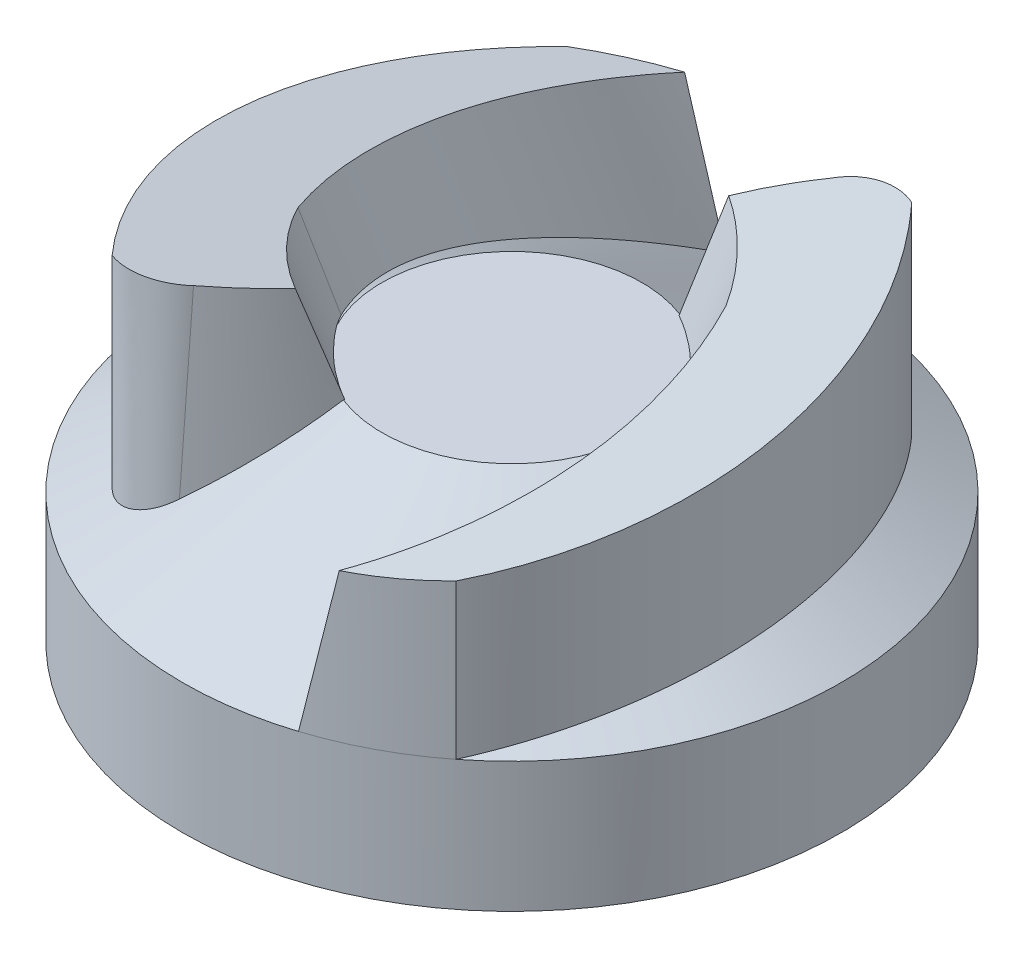
from build123d import *

# Parameters (mm, degrees)
CUT_EXTRUDE_1_DEPTH      = 132.165925626
CUT_EXTRUDE_1_DEPTH_BACK = 132.165925626
PATTERN_CIRCULAR_1_COUNT = 2
CUT_EXTRUDE_2_DEPTH      = 132.165925626


with BuildPart() as part:
    # Эскиз1 → Повернуть1 (revolve)
    with BuildSketch(Plane.XY, mode=Mode.PRIVATE) as revolve_1_sk:
        Polygon((0, 0), (-73.5, 0), (-73.5, 29), (-29, 55), (0, 55), align=None)
    revolve(revolve_1_sk.sketch.rotate(Axis((0, 0, 0), (0, -1, 0)), 270), axis=Axis((0, 0, 0), (0, -1, 0)))

    # Эскиз2 for По сечениям2 → По сечениям2 section 0
    with BuildSketch(Plane(origin=(0, 29, 0), x_dir=(-1, 0, 0), z_dir=(0, -1, 0))):
        with BuildLine():
            # circular arc as an exact rational Bezier (weights 1, cos(half-angle), 1)
            Bezier((39.466469787, -49.694809123), (86.422497659, 1.641217724), (45.380271287, 57.817652822), weights=[1, 0.773839067, 1])
            Bezier((45.380271287, 57.817652822), (34.990210983, 65.972666599), (22.410934831, 70), weights=[1, 0.984234087, 1])
            Bezier((22.410934831, 70), (39.972131567, 31.613018677), (20, -5.576629433), weights=[1, 0.895632627, 1])
            Bezier((20, -5.576629433), (14.31567319, -14.44600737), (5, -19.364916731), weights=[1, 0.96702533, 1])
            Bezier((5, -19.364916731), (11.820283108, -36.758324694), (25, -50), weights=[1, 0.979126148, 1])
            Bezier((25, -50), (32.393156545, -57.42791209), (39.466469787, -49.694809123), weights=[1, 0.690340696, 1])
        make_face()
    # Эскиз3 for По сечениям2 → По сечениям2 section 1
    with BuildSketch(Plane(origin=(0, 80, 0), x_dir=(1, 0, 0), z_dir=(0, 1, 0))):
        with BuildLine():
            Bezier((-32.410934831, 65.968032435), (-39.322570908, 62.57225757), (-45.380271287, 57.817652822), weights=[1, 0.994556139, 1])
            Bezier((-45.380271287, 57.817652822), (-86.422497659, 1.641217724), (-39.466469787, -49.694809123), weights=[1, 0.773839067, 1])
            Bezier((-39.466469787, -49.694809123), (-30.797796987, -53.302893985), (-25.13120111, -45.815981695), weights=[1, 0.790811163, 1])
            Bezier((-25.13120111, -45.815981695), (-19.944058149, -40.248445108), (-15.802261293, -33.864916731), weights=[1, 0.99619641, 1])
            Bezier((-15.802261293, -33.864916731), (-27.58094632, -26.902479263), (-35, -15.405932001), weights=[1, 0.973224743, 1])
            Bezier((-35, -15.405932001), (-55.902003331, 25.987274602), (-32.410934831, 65.968032435), weights=[1, 0.877862587, 1])
        make_face()
    loft_2 = loft()

    # Эскиз6 → Вырез-Вытянуть1 (cut, two sides: drawn at the far end of the back side and taken through both)
    with BuildSketch(Plane(origin=(0, 0, 0), x_dir=(0, 0, -1), z_dir=(1, 0, 0)).offset(-CUT_EXTRUDE_1_DEPTH_BACK)):
        Polygon((67.391079811, 62), (-50.626182403, 80), (-50.626182403, 96.194321308), (67.391079811, 98.711918652), align=None)
    extrude(amount=CUT_EXTRUDE_1_DEPTH + CUT_EXTRUDE_1_DEPTH_BACK, mode=Mode.SUBTRACT)

    # Круговой массив1: По сечениям2 ×2 about axis
    pattern_circular_1_axis = Axis((0, 0, 0), (0, 1, 0))
    for i in range(1, PATTERN_CIRCULAR_1_COUNT):
        add(loft_2.rotate(pattern_circular_1_axis, i * 360 / PATTERN_CIRCULAR_1_COUNT))

    # Эскиз7 → Вырез-Вытянуть2 (cut, through all)
    with BuildSketch(Plane(origin=(0, 0, 0), x_dir=(0, 0, -1), z_dir=(1, 0, 0))):
        Polygon((50.626182403, 80), (50.626182403, 117.416831393), (-67.391079811, 118.791932979), (-67.391079811, 62), align=None)
    extrude(amount=CUT_EXTRUDE_2_DEPTH, mode=Mode.SUBTRACT)


solid = part.part
